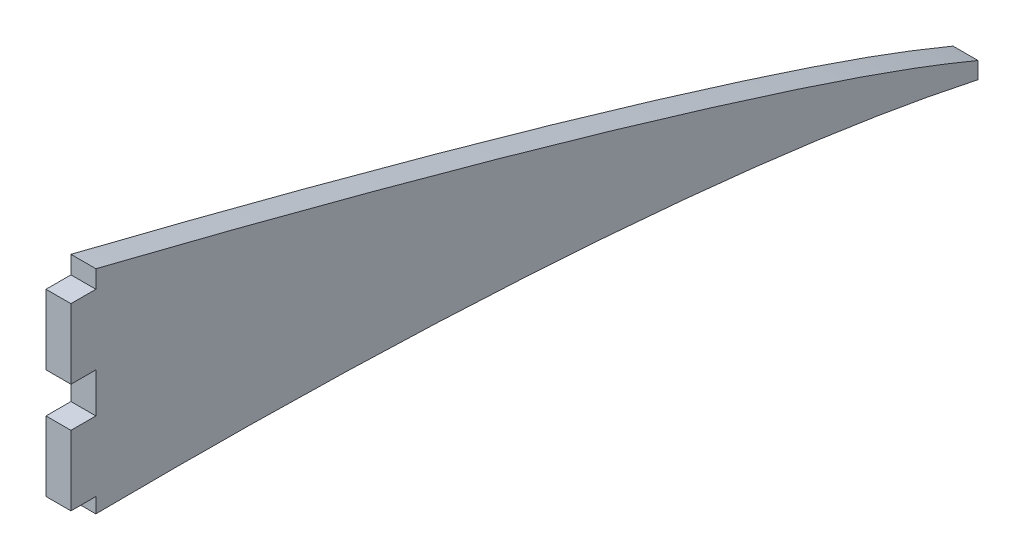
from build123d import *

# Parameters (mm, degrees)
BOSS_EXTRUDE1_DEPTH = 3.175
CUT_EXTRUDE1_DEPTH  = 3.175
SKETCH3_W           = 3.175
SKETCH3_H           = 8.89
BOSS_EXTRUDE3_DEPTH = 3.175


with BuildPart() as part:
    # Sketch1 → Boss-Extrude1 (new body)
    with BuildSketch(Plane(origin=(322.1355, 0, 0), x_dir=(0, 0, -1), z_dir=(1, 0, 0))):
        with BuildLine():
            add(Edge.make_bspline(
                [(764.914772229, -7.95557204), (762.592495307, -6.961678807), (760.248039666, -6.021012379), (755.381001417, -4.157972035), (752.855549055, -3.242485253), (747.781003843, -1.468246605), (745.231905095, -0.60950889), (737.561144422, 1.91039187), (732.426406495, 3.521427695), (722.132037513, 6.655448313), (716.971446899, 8.176495188), (706.629978042, 11.149031985), (701.449248475, 12.601031652), (691.072587644, 15.45291135), (685.876480278, 16.853200873), (671.324621162, 20.706496058), (661.956512682, 23.109383547), (652.571489798, 25.444691841)],
                knots=[0.066165924, 0.066165924, 0.066165924, 0.066165924, 0.125, 0.125, 0.1875, 0.1875, 0.25, 0.25, 0.375, 0.375, 0.5, 0.5, 0.625, 0.625, 0.75, 0.75, 0.974669525, 0.974669525, 0.974669525, 0.974669525], degree=3))
            Line((652.571489798, 25.444691841), (652.571489798, -2.239853871))
            add(Edge.make_bspline(
                [(652.571489798, -2.239853871), (659.535508053, -2.166526792), (666.500386762, -2.172540218), (679.343468905, -2.343824355), (685.222739923, -2.485063976), (696.978954297, -2.909271923), (702.85456416, -3.191578316), (714.592323323, -3.919191383), (720.455505411, -4.364295636), (729.239801176, -5.181453913), (732.167256327, -5.479520855), (738.010202726, -6.135780349), (740.925935315, -6.494041299), (749.652482821, -7.677212837), (755.443511526, -8.605976907), (762.435970423, -9.996546686), (763.676377356, -10.253772029), (764.914772229, -10.521558234)],
                knots=[0.775497337, 0.775497337, 0.775497337, 0.775497337, 0.8125, 0.8125, 0.84375, 0.84375, 0.875, 0.875, 0.90625, 0.90625, 0.921875, 0.921875, 0.9375, 0.9375, 0.96875, 0.96875, 0.975501731, 0.975501731, 0.975501731, 0.975501731], degree=3))
            Line((764.914772229, -10.521558234), (764.914772229, -7.95557204))
        make_face()
    extrude(amount=-BOSS_EXTRUDE1_DEPTH)

    # Sketch2 → Cut-Extrude1 (cut)
    with BuildSketch(Plane.ZY.offset(-318.9605)):
        with BuildLine():
            Line((-649.396489798, 25.593288016), (-650.006698592, 28.058900562))
            add(Edge.make_bspline(
                [(-650.006698592, 28.058900562), (-660.51321247, 25.45866754), (-681.483078121, 20.093474052), (-707.597104431, 12.962630416), (-728.392690314, 6.856018534), (-743.920155817, 2.015224435), (-756.792636164, -2.379192874), (-766.929271878, -6.418935387), (-771.93415167, -8.70689296), (-774.395298331, -9.920762993)],
                knots=[0, 0, 0, 0, 0.25, 0.5, 0.625, 0.75, 0.875, 0.9375, 1, 1, 1, 1], degree=3))
            Line((-774.395298331, -9.920762993), (-773.271760863, -12.198758506))
            add(Edge.make_bspline(
                [(-649.396489798, 25.593288016), (-659.890092199, 22.996250426), (-670.36307543, 20.318524911), (-686.038941126, 16.170415704), (-691.258573313, 14.76557782), (-701.684945224, 11.905450655), (-706.891809106, 10.449729715), (-717.284977007, 7.471750728), (-722.471467171, 5.948931584), (-730.231305632, 3.598018149), (-732.814554878, 2.803107207), (-737.973199119, 1.186961553), (-740.549325052, 0.366607699), (-745.688759805, -1.3098747), (-748.250861629, -2.166692715), (-753.351930275, -3.936762543), (-755.890796198, -4.850260484), (-760.932732715, -6.76457283), (-763.436647752, -7.763327362), (-767.155712151, -9.351246242), (-768.389182844, -9.895718895), (-770.8414182, -11.020536997), (-772.060077224, -11.601140135), (-773.271760863, -12.198758506)],
                knots=[0, 0, 0, 0, 0.25, 0.25, 0.375, 0.375, 0.5, 0.5, 0.625, 0.625, 0.6875, 0.6875, 0.75, 0.75, 0.8125, 0.8125, 0.875, 0.875, 0.9375, 0.9375, 0.96875, 0.96875, 1, 1, 1, 1], degree=3))
        make_face()
    extrude(amount=-CUT_EXTRUDE1_DEPTH, mode=Mode.SUBTRACT)

    # Sketch3 → Boss-Extrude3 (add)
    with BuildSketch(Plane.XY.offset(-652.571489798)):
        with Locations((320.548, 18.094665768)):
            Rectangle(SKETCH3_W, SKETCH3_H)
        with Locations((320.548, 4.124665768)):
            Rectangle(SKETCH3_W, SKETCH3_H)
    extrude(amount=BOSS_EXTRUDE3_DEPTH)


solid = part.part
